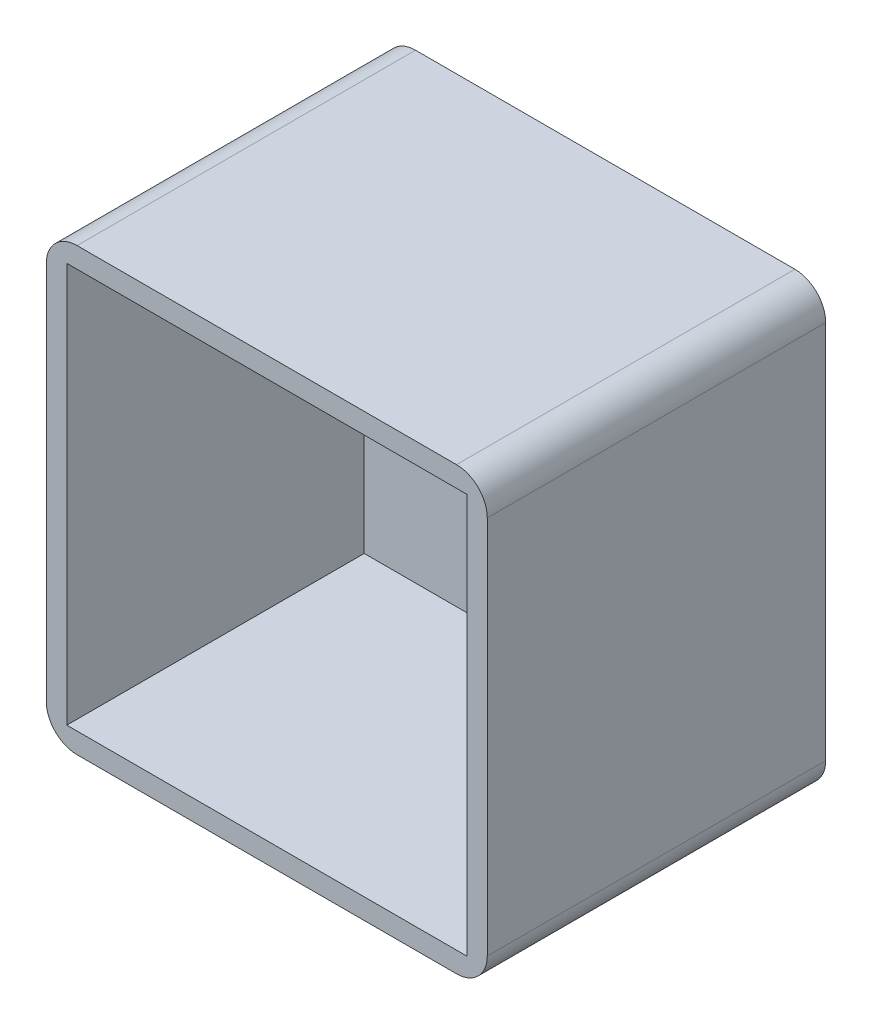
from build123d import *

# Parameters (mm, degrees)
SKETCH1_W           = 43
SKETCH1_H           = 43
BOSS_EXTRUDE1_DEPTH = 45
SKETCH3_R           = 3
SKETCH3_R_2         = 7.25
CUT_EXTRUDE4_DEPTH  = 38
SKETCH6_W           = 39
SKETCH6_H           = 39
CUT_EXTRUDE5_DEPTH  = 29
SKETCH7_W           = 43
SKETCH7_H           = 43
SKETCH7_W_2         = 18.4
SKETCH7_H_2         = 18.4
CUT_EXTRUDE8_DEPTH  = 12
FILLET2_R           = 5
FILLET3_R           = 3
SKETCH10_W          = 20.235048465
SKETCH10_H          = 19.323901817
CUT_EXTRUDE9_DEPTH  = 7


with BuildPart() as part:
    # Sketch1 → Boss-Extrude1 (new body)
    with BuildSketch(Plane(origin=(0, 0, 0), x_dir=(0, 1, 0), z_dir=(0, 0, 1))):
        with Locations((-19.5, 19.5)):
            Rectangle(SKETCH1_W, SKETCH1_H)
    extrude(amount=BOSS_EXTRUDE1_DEPTH)

    # Sketch3 → Cut-Extrude4 (cut)
    with BuildSketch(Plane.XY.offset(45)):
        with Locations((-20, -3.506761261)):
            Circle(SKETCH3_R)
        with Locations((-20, -19)):
            Circle(SKETCH3_R_2)
        with BuildLine():
            Line((-6, -13), (-6, -25))
            ThreePointArc((-6, -25), (-3, -28), (0, -25))
            Line((0, -25), (0, -13))
            ThreePointArc((0, -13), (-3, -10), (-6, -13))
        make_face()
        with BuildLine():
            Line((-33, -13), (-33, -25))
            ThreePointArc((-33, -25), (-36, -28), (-39, -25))
            Line((-39, -25), (-39, -13))
            ThreePointArc((-39, -13), (-36, -10), (-33, -13))
        make_face()
    extrude(amount=-CUT_EXTRUDE4_DEPTH, mode=Mode.SUBTRACT)

    # Sketch6 → Cut-Extrude5 (cut)
    with BuildSketch(Plane.XY.offset(45)):
        with Locations((-19.5, -19.5)):
            Rectangle(SKETCH6_W, SKETCH6_H)
    extrude(amount=-CUT_EXTRUDE5_DEPTH, mode=Mode.SUBTRACT)

    # Sketch7 → Cut-Extrude8 (cut)
    with BuildSketch(Plane(origin=(0, 0, 0), x_dir=(1, 0, 0), z_dir=(0, 0, -1))):
        with Locations((-19.5, 19.5)):
            Rectangle(SKETCH7_W, SKETCH7_H)
        with Locations((-20.012556467, 19.015852406)):
            Rectangle(SKETCH7_W_2, SKETCH7_H_2, mode=Mode.SUBTRACT)
    extrude(amount=-CUT_EXTRUDE8_DEPTH, mode=Mode.SUBTRACT)

    # Fillet2
    fillet2_edges = [part.edges().sort_by_distance(p)[0] for p in [
        (-10.812556467, -9.815852406, 6),
        (-10.812556467, -28.215852406, 6),
        (-29.212556467, -28.215852406, 6),
        (-29.212556467, -9.815852406, 6),
    ]]
    fillet(fillet2_edges, radius=FILLET2_R)

    # Fillet3
    fillet3_edges = [part.edges().sort_by_distance(p)[0] for p in [
        (-41, -41, 28.5),
        (2, -41, 28.5),
        (2, 2, 28.5),
        (-41, 2, 28.5),
    ]]
    fillet(fillet3_edges, radius=FILLET3_R)

    # Sketch10 → Cut-Extrude9 (cut)
    with BuildSketch(Plane(origin=(0, 0, 0), x_dir=(1, 0, 0), z_dir=(0, 0, -1))):
        with Locations((-19.898626658, 18.797657793)):
            Rectangle(SKETCH10_W, SKETCH10_H)
    extrude(amount=-CUT_EXTRUDE9_DEPTH, mode=Mode.SUBTRACT)


solid = part.part
